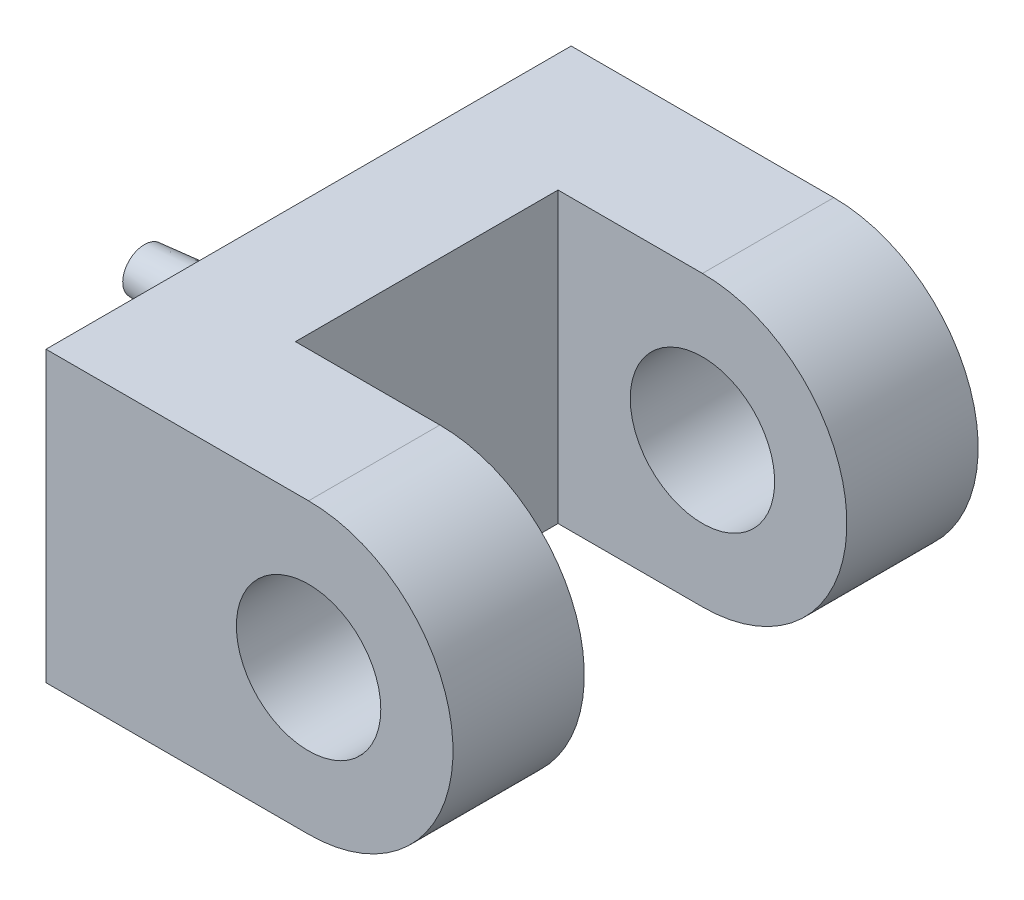
from build123d import *

# Parameters (mm, degrees)
SKETCH2_R               = 11
BOSS_EXTRUDE1_DEPTH     = 40
CUT_EXTRUDE1_DEPTH      = 61.695963622
CUT_EXTRUDE1_DEPTH_BACK = 61.695963622
SKETCH3_W               = 44
SKETCH3_H               = 40
SKETCH4_R               = 5.5
BOSS_EXTRUDE2_DEPTH     = 25
BOSS_EXTRUDE2_TAPER     = 5


with BuildPart() as part:
    # Sketch2 → Boss-Extrude1 (new, symmetric)
    with BuildSketch(Plane.XY):
        with BuildLine():
            Line((0, 22), (-40, 22))
            Line((-40, 22), (-40, -22))
            Line((-40, -22), (0, -22))
            ThreePointArc((0, -22), (22, 0), (0, 22))
        make_face()
        Circle(SKETCH2_R, mode=Mode.SUBTRACT)
    extrude(amount=BOSS_EXTRUDE1_DEPTH, both=True)

    # Sketch3 → Cut-Extrude1 (cut, two sides: drawn at the far end of the back side and taken through both)
    with BuildSketch(Plane(origin=(0, 0, 0), x_dir=(1, 0, 0), z_dir=(0, 1, 0)).offset(-CUT_EXTRUDE1_DEPTH_BACK)):
        Rectangle(SKETCH3_W, SKETCH3_H)
    extrude(amount=CUT_EXTRUDE1_DEPTH + CUT_EXTRUDE1_DEPTH_BACK, mode=Mode.SUBTRACT)

    # Sketch4 → Boss-Extrude2 (add)
    with BuildSketch(Plane.ZY.offset(40)):
        Circle(SKETCH4_R)
    extrude(amount=BOSS_EXTRUDE2_DEPTH, taper=BOSS_EXTRUDE2_TAPER)


solid = part.part
